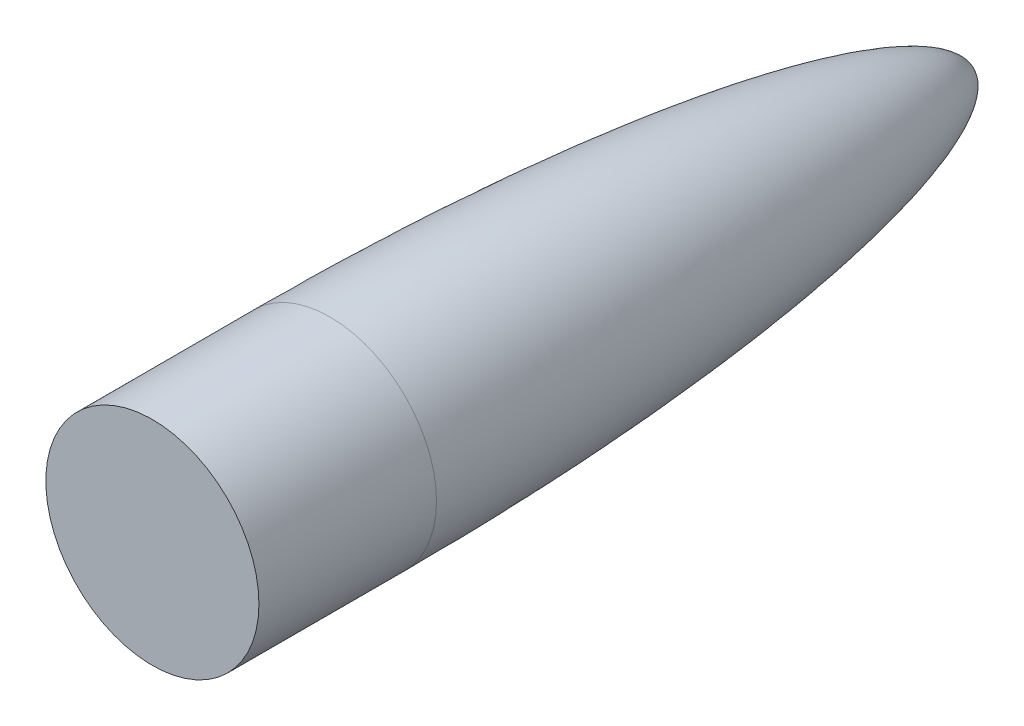
from build123d import *

# Parameters (mm, degrees)
SKETCH2_R           = 76.2
BOSS_EXTRUDE1_DEPTH = 127


with BuildPart() as part:
    # Sketch1 → Revolve1 (revolve)
    with BuildSketch(Plane(origin=(0, 0, 0), x_dir=(0, 0, -1), z_dir=(1, 0, 0))):
        with BuildLine():
            Line((0, 76.2), (0, 0))
            Line((0, 0), (457.2, 0))
            add(Edge.make_bspline(
                [(0, 76.2), (0.995244189, 76.2), (3.01641859, 76.198842555), (6.722019403, 76.193634051), (10.824280737, 76.179742878), (15.325060334, 76.158901546), (19.613089499, 76.131104558), (24.020975902, 76.096344577), (28.362850291, 76.054612408), (33.829586727, 75.993718152), (40.370117024, 75.906652678), (50.192682054, 75.74973543), (63.282080413, 75.484066088), (78.554992233, 75.091009492), (93.822641827, 74.596492522), (106.907850963, 74.098553478), (117.809424576, 73.633230741), (126.529690709, 73.230304256), (137.427887861, 72.68770416), (150.502604003, 71.973193153), (165.750929013, 71.04458297), (183.168839163, 69.847325623), (200.576347757, 68.50731355), (217.971608603, 67.016377106), (235.352399191, 65.364784332), (252.715935846, 63.540614009), (270.058940881, 61.529567187), (287.376938666, 59.313605436), (308.986583679, 56.260106437), (334.841968839, 52.084297907), (363.148103266, 46.636624279), (391.164847979, 39.826216584), (413.166178505, 32.959393199), (428.331965643, 26.887853975), (437.961024741, 22.05744974), (444.276883573, 18.134713622), (448.481131891, 14.927506736), (451.362493851, 12.239607519), (453.370933283, 9.939081967), (454.795004944, 7.904438878), (455.800493323, 6.060462717), (456.472604248, 4.412963809), (456.955614881, 2.715219236), (457.150080642, 1.423732381), (457.199999783, 0.534505426), (457.2, 0)],
                knots=[0.087915568, 0.087915568, 0.087915568, 0.087915568, 0.087915568, 0.096308118, 0.104700669, 0.113093219, 0.121485769, 0.129878319, 0.138270869, 0.146663419, 0.155055969, 0.171841069, 0.188626169, 0.222196369, 0.255766569, 0.28933677, 0.30612187, 0.32290697, 0.33969207, 0.35647717, 0.390047371, 0.423617571, 0.457187771, 0.490757971, 0.524328171, 0.557898371, 0.59146857, 0.625038769, 0.65860897, 0.692179172, 0.759319568, 0.826459948, 0.880250059, 0.913820236, 0.936431699, 0.951973665, 0.9630043, 0.97092318, 0.977039405, 0.982232135, 0.98645073, 0.989985916, 0.993160505, 0.995889308, 1, 1, 1, 1, 1], degree=4))
        make_face()
    revolve(axis=Axis((0, 0, -480.06), (0, 0, 1)))

    # Sketch2 → Boss-Extrude1 (add)
    with BuildSketch(Plane.XY):
        Circle(SKETCH2_R)
    extrude(amount=BOSS_EXTRUDE1_DEPTH)


solid = part.part
